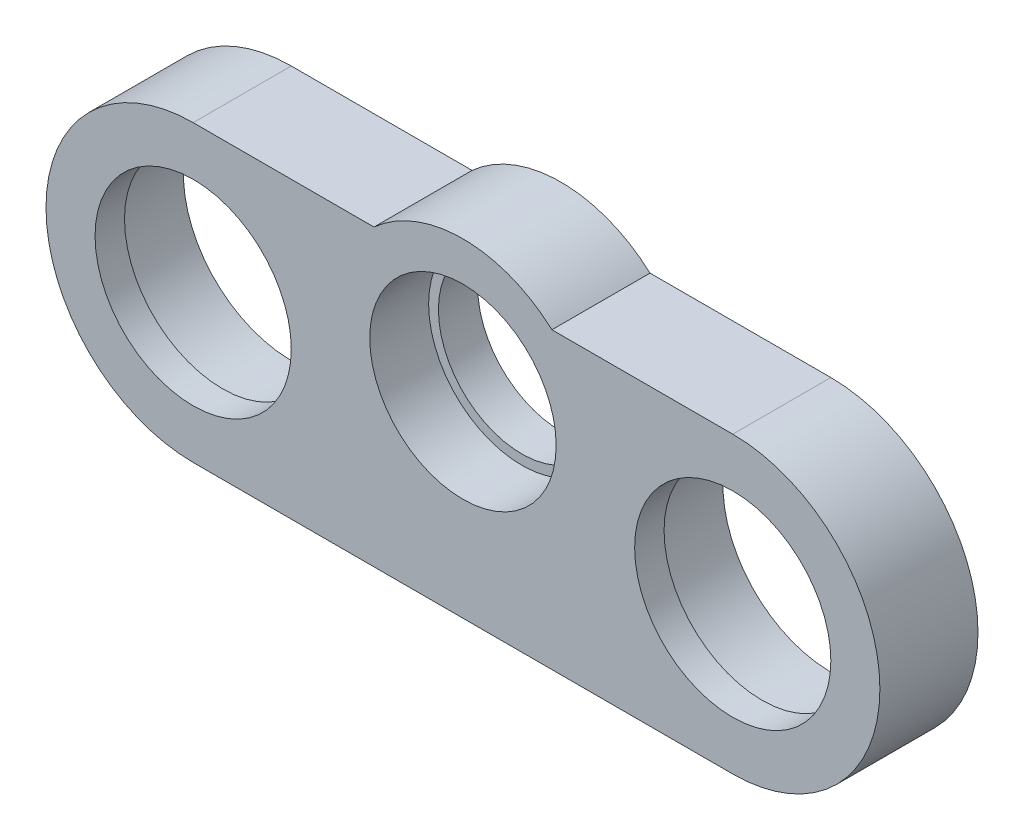
from build123d import *

# Parameters (mm, degrees)
SKETCH1_R           = 11
SKETCH1_R_2         = 9.5
BOSS_EXTRUDE1_DEPTH = 10
BOSS_EXTRUDE2_START = -3
SKETCH2_R           = 11
SKETCH2_R_2         = 10
BOSS_EXTRUDE2_DEPTH = 3
SKETCH4_R           = 9.5
SKETCH4_R_2         = 8.5
BOSS_EXTRUDE3_DEPTH = 4


with BuildPart() as part:
    # Sketch1 → Boss-Extrude1 (new body)
    with BuildSketch(Plane.XY):
        with BuildLine():
            Line((-27.5, -15), (27.5, -15))
            ThreePointArc((27.5, -15), (42.5, 0), (27.5, 15))
            Line((27.5, 15), (9.069178574, 15))
            ThreePointArc((9.069178574, 15), (0, 18.5), (-9.069178574, 15))
            Line((-9.069178574, 15), (-27.5, 15))
            ThreePointArc((-27.5, 15), (-42.5, 0), (-27.5, -15))
        make_face()
        with Locations((-27.5, 0)):
            Circle(SKETCH1_R, mode=Mode.SUBTRACT)
        with Locations((27.5, 0)):
            Circle(SKETCH1_R, mode=Mode.SUBTRACT)
        with Locations((0, 5)):
            Circle(SKETCH1_R_2, mode=Mode.SUBTRACT)
    extrude(amount=BOSS_EXTRUDE1_DEPTH)

    # Sketch2 → Boss-Extrude2 (add)
    # profile 1 of 2: a face of its own
    with BuildSketch(Plane.XY.offset(10).offset(BOSS_EXTRUDE2_START)):
        with Locations((-27.5, 0)):
            Circle(SKETCH2_R)
        with Locations((-27.5, 0)):
            Circle(SKETCH2_R_2, mode=Mode.SUBTRACT)
    # profile 2 of 2: a face of its own
    with BuildSketch(Plane.XY.offset(10).offset(BOSS_EXTRUDE2_START)):
        with Locations((27.5, 0)):
            Circle(SKETCH2_R)
        with Locations((27.5, 0)):
            Circle(SKETCH2_R_2, mode=Mode.SUBTRACT)
    extrude(amount=BOSS_EXTRUDE2_DEPTH)

    # Sketch4 → Boss-Extrude3 (add)
    with BuildSketch(Plane(origin=(0, 0, 0), x_dir=(-1, 0, 0), z_dir=(0, 0, -1))):
        with Locations((0, 5)):
            Circle(SKETCH4_R)
        with Locations((0, 5)):
            Circle(SKETCH4_R_2, mode=Mode.SUBTRACT)
    extrude(amount=-BOSS_EXTRUDE3_DEPTH)


solid = part.part
